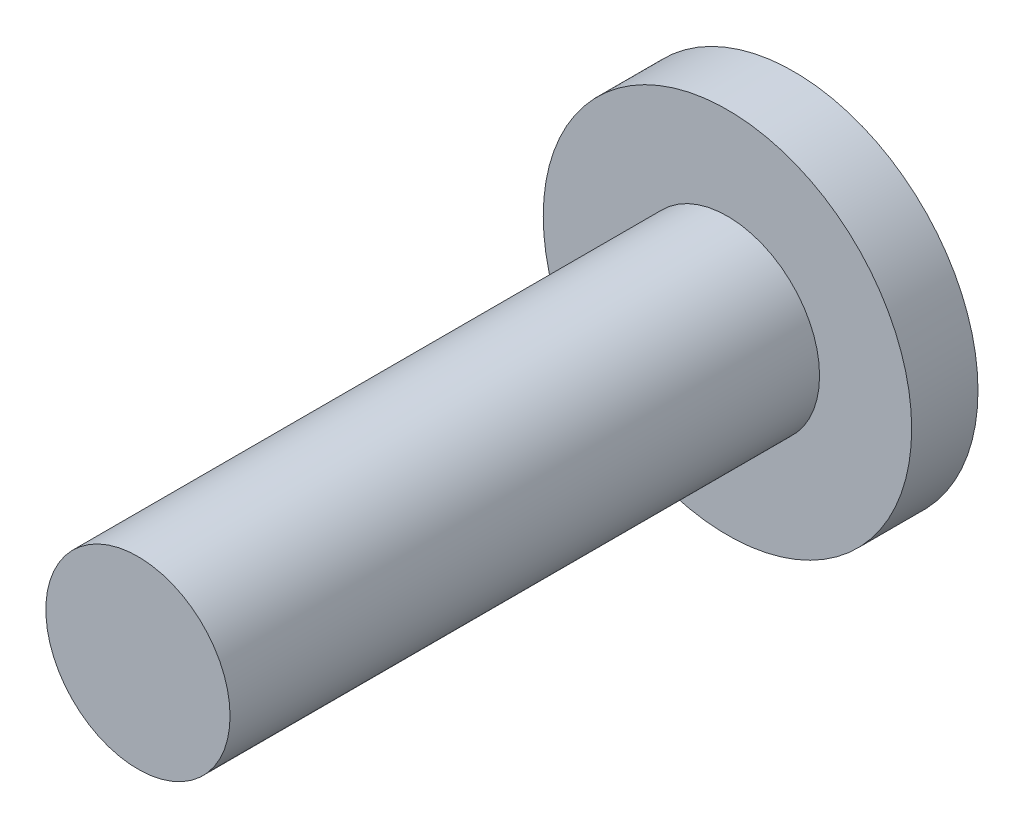
from build123d import *

# Parameters (mm, degrees)
SKETCH_1_R          = 2.5
EXTRUDE_1_DEPTH     = 0.9
SKETCH_2_R          = 1.25
EXTRUDE_2_DEPTH     = 8
CUT_EXTRUDE_1_DEPTH = 1


with BuildPart() as part:
    # 草图1 → 凸台-拉伸1 (new body)
    with BuildSketch(Plane.XY):
        Circle(SKETCH_1_R)
    extrude(amount=EXTRUDE_1_DEPTH)

    # 草图2 → 凸台-拉伸2 (add)
    with BuildSketch(Plane.XY.offset(0.9)):
        Circle(SKETCH_2_R)
    extrude(amount=EXTRUDE_2_DEPTH)

    # 草图3 → 切除-拉伸1 (cut)
    with BuildSketch(Plane(origin=(0, 0, 0), x_dir=(-1, 0, 0), z_dir=(0, 0, -1))):
        Polygon((0.866025404, 0), (0.433012702, 0.75), (-0.433012702, 0.75), (-0.866025404, 0), (-0.433012702, -0.75), (0.433012702, -0.75), align=None)
    extrude(amount=-CUT_EXTRUDE_1_DEPTH, mode=Mode.SUBTRACT)


solid = part.part
